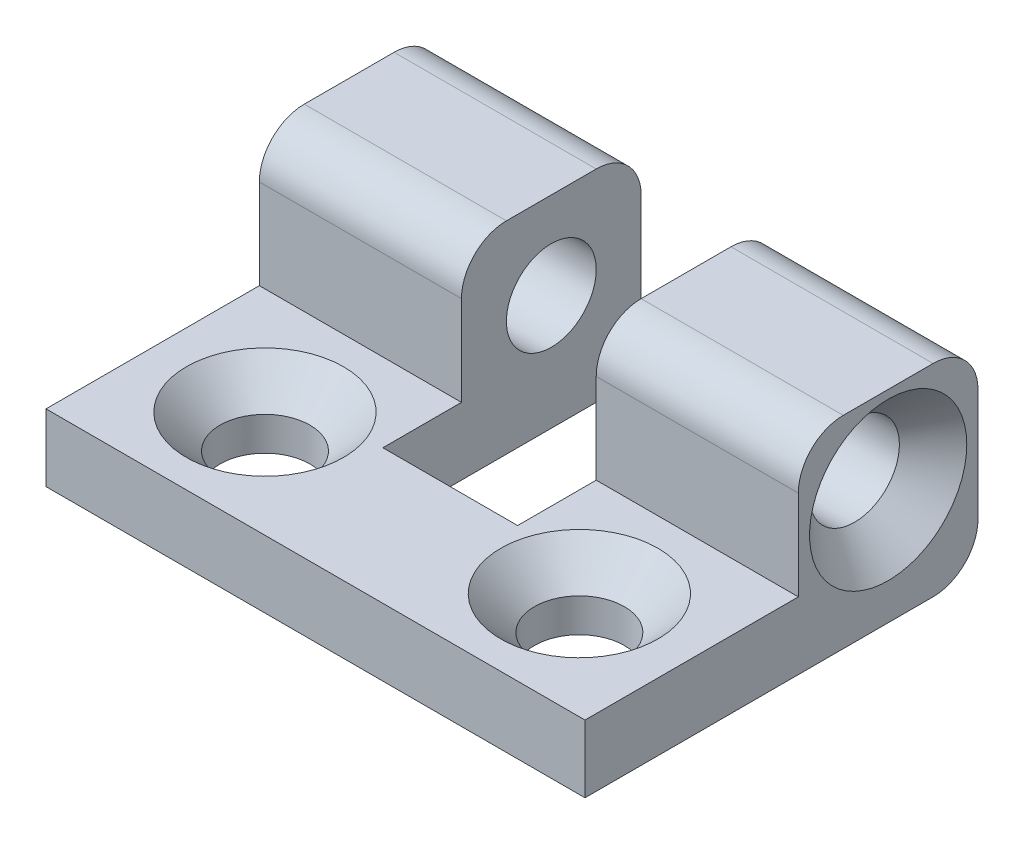
from build123d import *

# Parameters (mm, degrees)
ESQUISSE1_R                  = 2
BOSS_EXTRU_1_DEPTH           = 24
ENL_V_MAT_EXTRU_1_DEPTH      = 24
ENL_V_MAT_EXTRU_1_DEPTH_BACK = 24
ESQUISSE2_R                  = 2
ESQUISSE2_W                  = 6
ESQUISSE2_H                  = 11.5
CHANFREIN1_SIZE              = 1.5


with BuildPart() as part:
    # Esquisse1 → Boss.-Extru.1 (new body)
    with BuildSketch(Plane(origin=(0, 0, 0), x_dir=(0, 0, -1), z_dir=(1, 0, 0))):
        with BuildLine():
            Line((-8.240740741, 1.277777778), (1.259259259, 1.277777778))
            Line((1.259259259, 1.277777778), (1.259259259, 5.277777778))
            ThreePointArc((1.259259259, 5.277777778), (1.845045697, 6.69199134), (3.259259259, 7.277777778))
            Line((3.259259259, 7.277777778), (7.259259259, 7.277777778))
            ThreePointArc((7.259259259, 7.277777778), (8.673472822, 6.69199134), (9.259259259, 5.277777778))
            Line((9.259259259, 5.277777778), (9.259259259, 0.277777778))
            ThreePointArc((9.259259259, 0.277777778), (8.673472822, -1.136435785), (7.259259259, -1.722222222))
            Line((7.259259259, -1.722222222), (-8.240740741, -1.722222222))
            Line((-8.240740741, -1.722222222), (-8.240740741, 1.277777778))
        make_face()
        with Locations((5.259259259, 3.401253161)):
            Circle(ESQUISSE1_R, mode=Mode.SUBTRACT)
    extrude(amount=BOSS_EXTRU_1_DEPTH)

    # Esquisse2 → Enlèv. mat.-Extru.1 (cut, two sides: drawn at the far end of the back side and taken through both)
    with BuildSketch(Plane(origin=(0, 1.277777778, 0), x_dir=(1, 0, 0), z_dir=(0, 1, 0)).offset(-ENL_V_MAT_EXTRU_1_DEPTH_BACK)):
        with Locations(Location((19, -3.490740741, 0), (0, 0, 90))):
            Circle(ESQUISSE2_R)
        with Locations(Location((5, -3.490740741, 0), (0, 0, 90))):
            Circle(ESQUISSE2_R)
        with Locations((12, 3.509259259)):
            Rectangle(ESQUISSE2_W, ESQUISSE2_H)
    extrude(amount=ENL_V_MAT_EXTRU_1_DEPTH + ENL_V_MAT_EXTRU_1_DEPTH_BACK, mode=Mode.SUBTRACT)

    # Chanfrein1
    chanfrein1_edges = [part.edges().sort_by_distance(p)[0] for p in [
        (24, 3.401253161, -3.259259259),
        (19, 1.277777778, 5.490740741),
        (5, 1.277777778, 5.490740741),
    ]]
    chamfer(chanfrein1_edges, length=CHANFREIN1_SIZE)


solid = part.part
